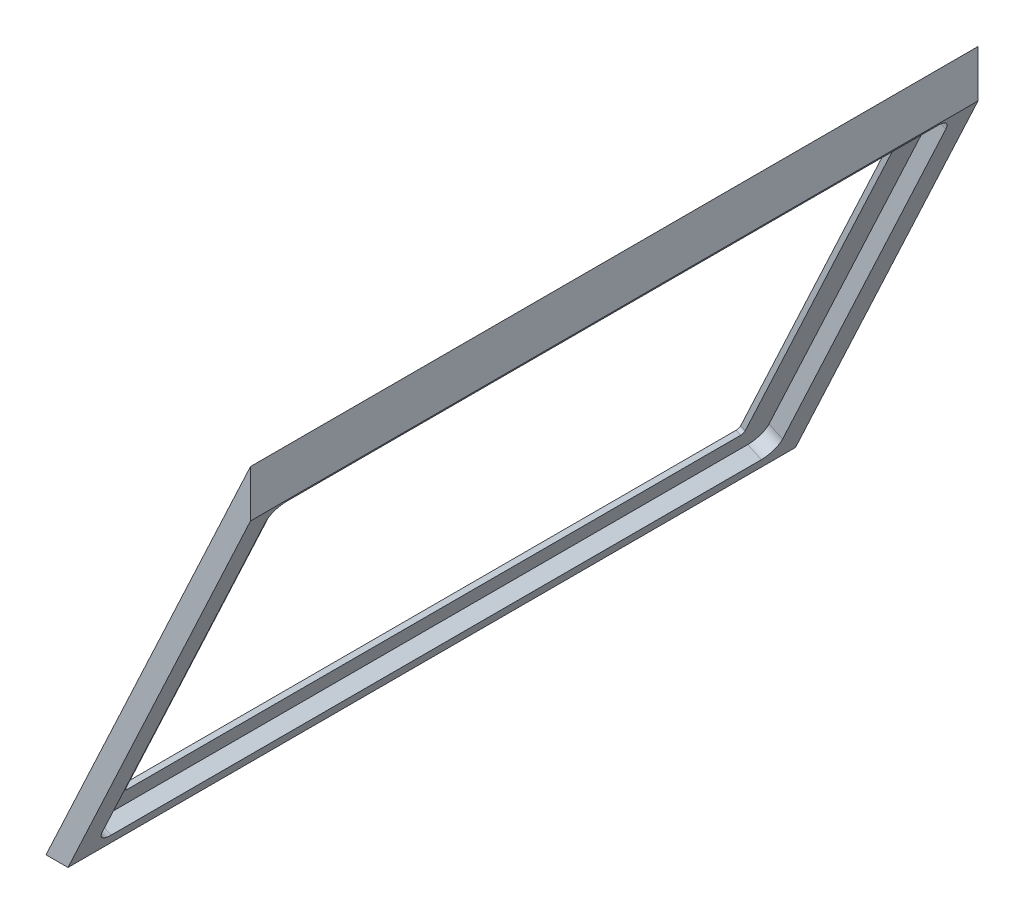
from build123d import *

# Parameters (mm, degrees)
BOSS_EXTRUDE1_DEPTH = 115.8875
CUT_EXTRUDE1_REACH  = 194.846
SKETCH3_W           = 213.51875
SKETCH3_H           = 129.38125
CUT_EXTRUDE3_DEPTH  = 4.7625
FILLET1_R           = 3.175
CUT_EXTRUDE4_START  = -4.7625
CUT_EXTRUDE4_DEPTH  = 4.7625


with BuildPart() as part:
    # Sketch1 → Boss-Extrude1 (new, symmetric)
    with BuildSketch(Plane.XY):
        Polygon((0, 0), (65.143179844, 139.7), (65.143179844, 124.674619947), (7.006449785, 0), align=None)
    extrude(amount=BOSS_EXTRUDE1_DEPTH, both=True)

    # Sketch2 → Cut-Extrude1 (cut, up to next)
    with BuildSketch(Plane(origin=(0, 0, 0), x_dir=(0, 0, 1), z_dir=(-0.906307787036651, 0.42261826174069705, 0)), mode=Mode.PRIVATE) as cut_extrude1_sk1:
        with BuildLine():
            Line((-98.679, 15.944158686), (-98.679, 128.720158686))
            ThreePointArc((-98.679, 128.720158686), (-98.38142049, 129.438579176), (-97.663, 129.736158686))
            Line((-97.663, 129.736158686), (97.663, 129.736158686))
            ThreePointArc((97.663, 129.736158686), (98.38142049, 129.438579176), (98.679, 128.720158686))
            Line((98.679, 128.720158686), (98.679, 15.944158686))
            ThreePointArc((98.679, 15.944158686), (98.38142049, 15.225738197), (97.663, 14.928158686))
            Line((97.663, 14.928158686), (-97.663, 14.928158686))
            ThreePointArc((-97.663, 14.928158686), (-98.38142049, 15.225738197), (-98.679, 15.944158686))
        make_face()
    cut_extrude1_tool1 = extrude(cut_extrude1_sk1.sketch, amount=-CUT_EXTRUDE1_REACH, mode=Mode.PRIVATE) & part.part
    add(cut_extrude1_tool1.solids().sort_by_distance((30.568891, 65.555199, 0))[0], mode=Mode.SUBTRACT)

    # Sketch3 → Cut-Extrude3 (cut)
    with BuildSketch(Plane(origin=(5.755054448, -2.683625962, 0), x_dir=(0, 0, -1), z_dir=(0.906307787036651, -0.42261826174069717, 0))):
        with Locations((-0.396875, 73.519608686)):
            Rectangle(SKETCH3_W, SKETCH3_H)
    extrude(amount=-CUT_EXTRUDE3_DEPTH, mode=Mode.SUBTRACT)

    # Fillet1
    fillet1_edges = [part.edges().sort_by_distance(p)[0] for p in [
        (7.328198768, 6.32451044, 107.15625),
        (62.007077745, 123.583744812, 107.15625),
        (62.007077745, 123.583744812, -106.3625),
        (7.328198768, 6.32451044, -106.3625),
    ]]
    fillet(fillet1_edges, radius=FILLET1_R)

    # Sketch4 → Cut-Extrude4 (cut)
    with BuildSketch(Plane(origin=(5.755054448, -2.683625962, 0), x_dir=(0, 0, -1), z_dir=(0.906307787036651, -0.42261826174069717, 0)).offset(CUT_EXTRUDE4_START)):
        with BuildLine():
            Line((107.95, 12.003983686), (107.95, 135.035233686))
            ThreePointArc((107.95, 135.035233686), (106.555096045, 138.402829732), (103.1875, 139.797733686))
            Line((103.1875, 139.797733686), (-103.98125, 139.797733686))
            ThreePointArc((-103.98125, 139.797733686), (-107.348846045, 138.402829732), (-108.74375, 135.035233686))
            Line((-108.74375, 135.035233686), (-108.74375, 12.003983686))
            ThreePointArc((-108.74375, 12.003983686), (-107.348846045, 8.636387641), (-103.98125, 7.241483686))
            Line((-103.98125, 7.241483686), (103.1875, 7.241483686))
            ThreePointArc((103.1875, 7.241483686), (106.555096045, 8.636387641), (107.95, 12.003983686))
        make_face()
        with BuildLine():
            Line((-103.98125, 8.828983686), (103.1875, 8.828983686))
            ThreePointArc((103.1875, 8.828983686), (105.43256403, 9.758919656), (106.3625, 12.003983686))
            Line((106.3625, 12.003983686), (106.3625, 135.035233686))
            ThreePointArc((106.3625, 135.035233686), (105.43256403, 137.280297717), (103.1875, 138.210233686))
            Line((103.1875, 138.210233686), (-103.98125, 138.210233686))
            ThreePointArc((-103.98125, 138.210233686), (-106.22631403, 137.280297717), (-107.15625, 135.035233686))
            Line((-107.15625, 135.035233686), (-107.15625, 12.003983686))
            ThreePointArc((-107.15625, 12.003983686), (-106.22631403, 9.758919656), (-103.98125, 8.828983686))
        make_face(mode=Mode.SUBTRACT)
    extrude(amount=CUT_EXTRUDE4_DEPTH, mode=Mode.SUBTRACT)


solid = part.part
